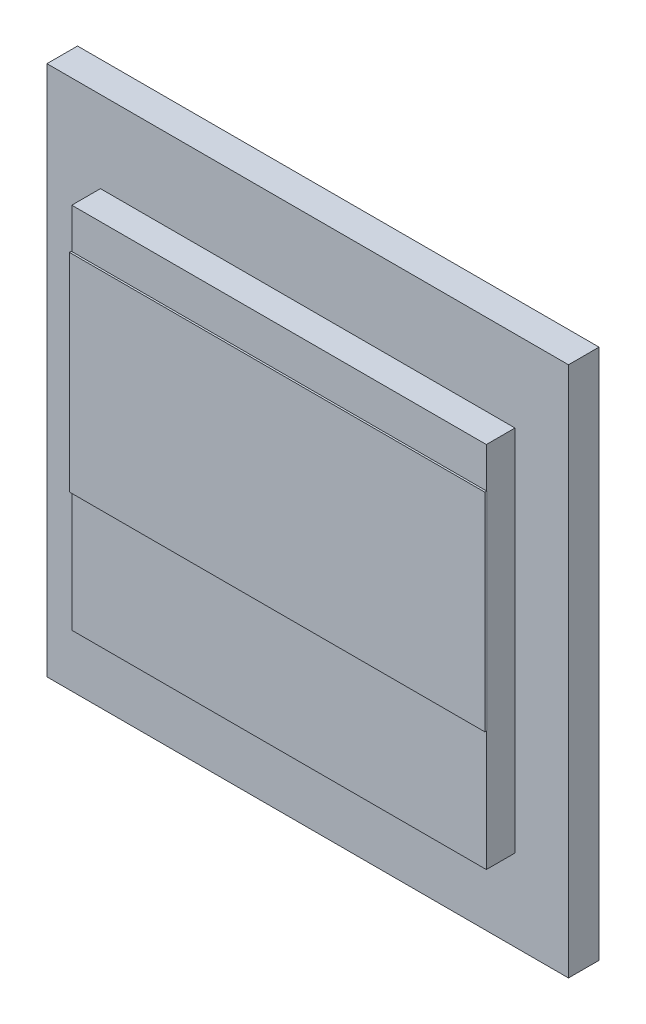
from build123d import *

# Parameters (mm, degrees)
SKETCH_1_W      = 27.3
SKETCH_1_H      = 27.8
EXTRUDE_1_DEPTH = 1.6
SKETCH_2_W      = 21.7
SKETCH_2_H      = 19.268
EXTRUDE_2_DEPTH = 1.5
SKETCH_3_W      = 21.744
SKETCH_3_H      = 10.864
EXTRUDE_3_DEPTH = 0.1


with BuildPart() as part:
    # 草图1 → 凸台-拉伸1 (new body)
    with BuildSketch(Plane.XY):
        Rectangle(SKETCH_1_W, SKETCH_1_H)
    extrude(amount=EXTRUDE_1_DEPTH)

    # 草图2 → 凸台-拉伸2 (add)
    with BuildSketch(Plane.XY.offset(1.6)):
        Rectangle(SKETCH_2_W, SKETCH_2_H)
    extrude(amount=EXTRUDE_2_DEPTH)

    # 草图3 → 凸台-拉伸3 (add)
    with BuildSketch(Plane.XY.offset(3.1)):
        with Locations((0, 2.102)):
            Rectangle(SKETCH_3_W, SKETCH_3_H)
    extrude(amount=EXTRUDE_3_DEPTH)


solid = part.part
